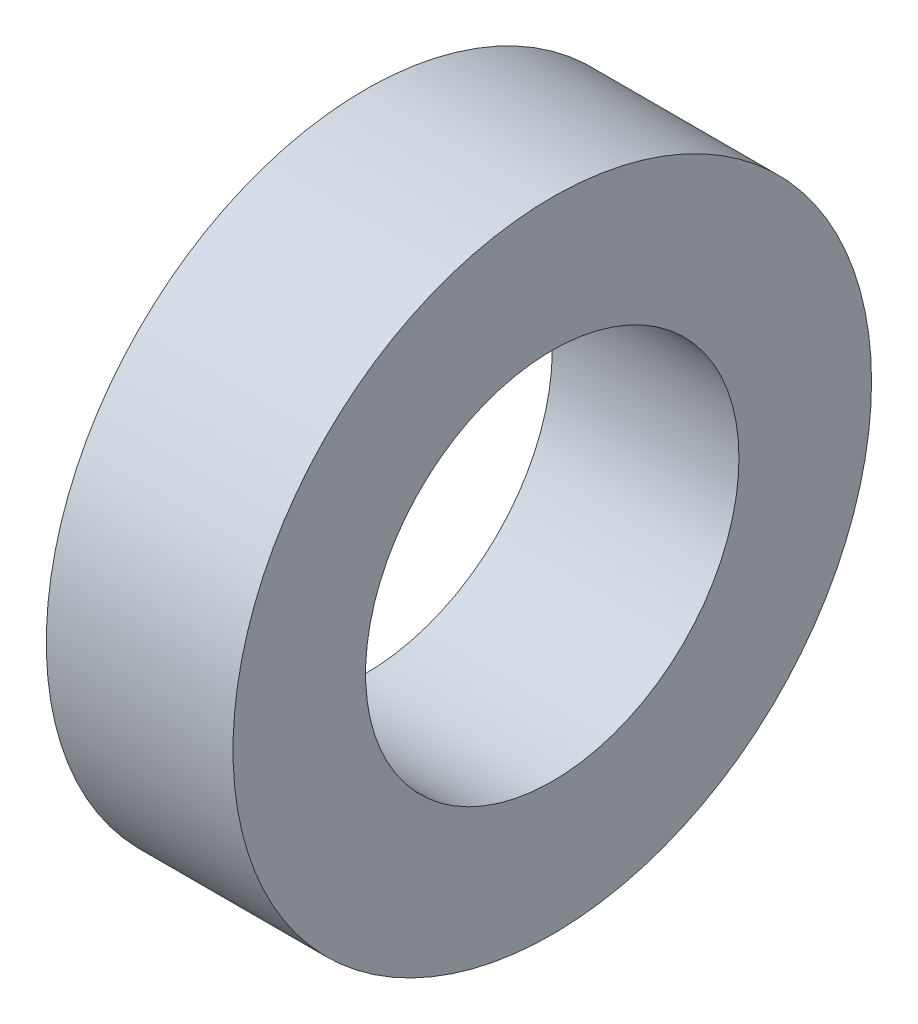
from build123d import *

# Parameters (mm, degrees)
SKETCH_1_R          = 8.55
EXTRUDE_1_DEPTH     = 5
SKETCH_2_R          = 5
CUT_EXTRUDE_1_DEPTH = 5


with BuildPart() as part:
    # 草图1 → 凸台-拉伸1 (new body)
    with BuildSketch(Plane(origin=(0, 0, 0), x_dir=(0, 0, -1), z_dir=(1, 0, 0))):
        Circle(SKETCH_1_R)
    extrude(amount=EXTRUDE_1_DEPTH)

    # 草图2 → 切除-拉伸1 (cut)
    with BuildSketch(Plane(origin=(5, 0, 0), x_dir=(0, 0, -1), z_dir=(1, 0, 0))):
        Circle(SKETCH_2_R)
    extrude(amount=-CUT_EXTRUDE_1_DEPTH, mode=Mode.SUBTRACT)


solid = part.part
